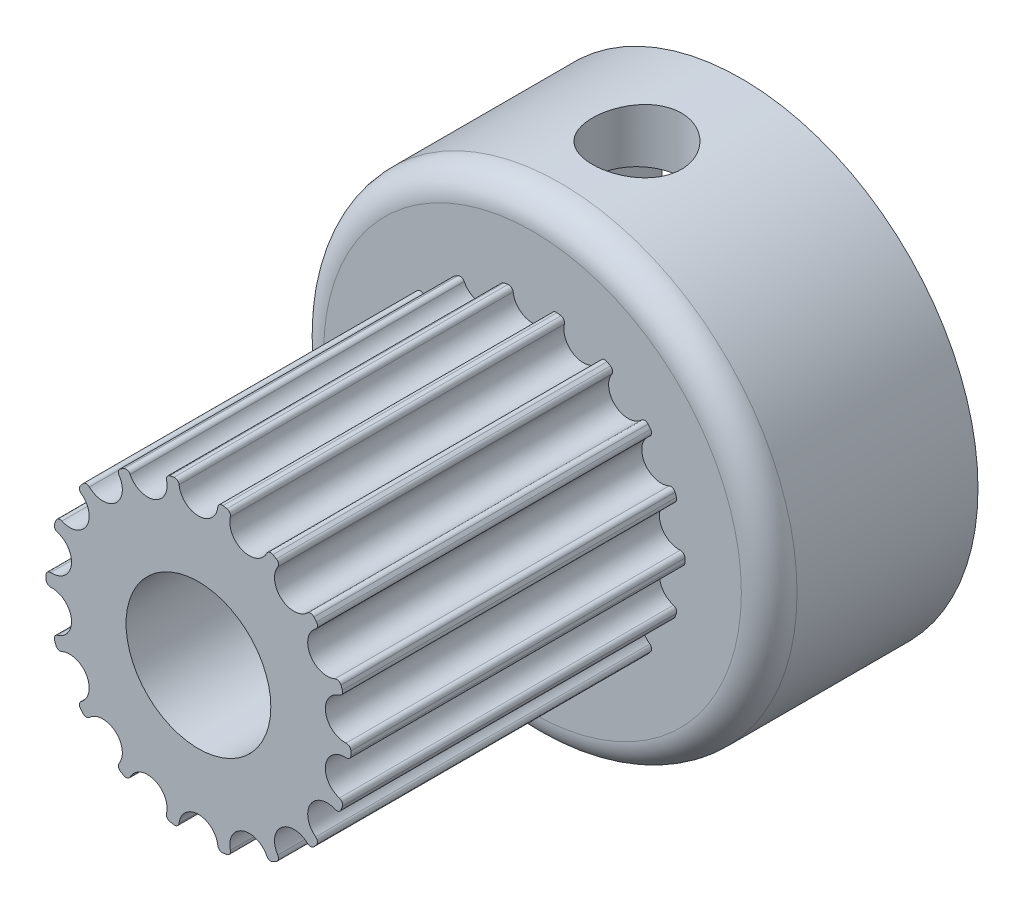
from build123d import *

# Parameters (mm, degrees)
SKETCH_1_R          = 8.5
SKETCH_1_R_2        = 2.6
EXTRUDE_1_DEPTH     = 7.5
FILLET_1_R          = 1
SKETCH_2_R          = 2.6
EXTRUDE_2_DEPTH     = 12
SKETCH_4_R          = 1.6
CUT_EXTRUDE_1_DEPTH = 23.907422415
SKETCH_5_W          = 5.7
SKETCH_5_H          = 2.7
CUT_EXTRUDE_2_DEPTH = 7.05


with BuildPart() as part:
    # 草图1 → 凸台-拉伸1 (new body)
    with BuildSketch(Plane.XY):
        Circle(SKETCH_1_R)
        Circle(SKETCH_1_R_2, mode=Mode.SUBTRACT)
    extrude(amount=EXTRUDE_1_DEPTH)

    # 圆角1
    fillet_1_edges = [part.edges().sort_by_distance(p)[0] for p in [
        (-8.5, 0, 7.5),
    ]]
    fillet(fillet_1_edges, radius=FILLET_1_R)

    # 草图2 → 凸台-拉伸2 (add)
    with BuildSketch(Plane.XY.offset(7.5)):
        with BuildLine():
            ThreePointArc((-0.880559418, 5.403724652), (-0.950723773, 5.391822448), (-1.020727493, 5.379009238))
            ThreePointArc((-1.020727493, 5.379009238), (-1.125431591, 5.308421125), (-1.14633793, 5.183887777))
            ThreePointArc((-1.14633793, 5.183887777), (-1.586973465, 4.36017376), (-2.453993032, 4.707940244))
            ThreePointArc((-2.453993032, 4.707940244), (-2.55005671, 4.789899987), (-2.675637867, 4.776671122))
            ThreePointArc((-2.675637867, 4.776671122), (-2.7375, 4.741489086), (-2.798899603, 4.705505925))
            ThreePointArc((-2.798899603, 4.705505925), (-2.873146715, 4.603363886), (-2.850199334, 4.479190428))
            ThreePointArc((-2.850199334, 4.479190428), (-2.982534509, 3.554446216), (-3.916209541, 3.584701658))
            ThreePointArc((-3.916209541, 3.584701658), (-4.034511753, 3.62886291), (-4.147994901, 3.573480558))
            ThreePointArc((-4.147994901, 3.573480558), (-4.194093326, 3.519262163), (-4.239483115, 3.464449151))
            ThreePointArc((-4.239483115, 3.464449151), (-4.274317943, 3.343073023), (-4.210284635, 3.234236608))
            ThreePointArc((-4.210284635, 3.234236608), (-4.018357874, 2.32), (-4.906073381, 2.029095147))
            ThreePointArc((-4.906073381, 2.029095147), (-5.032345136, 2.030131411), (-5.120042532, 1.9392755))
            ThreePointArc((-5.120042532, 1.9392755), (-5.144817099, 1.872560285), (-5.168722394, 1.80552868))
            ThreePointArc((-5.168722394, 1.80552868), (-5.159943344, 1.679558215), (-5.062547471, 1.59918612))
            ThreePointArc((-5.062547471, 1.59918612), (-4.569507974, 0.805727544), (-5.304192367, 0.228749815))
            ThreePointArc((-5.304192367, 0.228749815), (-5.423203425, 0.186536101), (-5.47453747, 0.071165197))
            ThreePointArc((-5.47453747, 0.071165197), (-5.475, 0), (-5.47453747, -0.071165197))
            ThreePointArc((-5.47453747, -0.071165197), (-5.423203425, -0.186536101), (-5.304192367, -0.228749815))
            ThreePointArc((-5.304192367, -0.228749815), (-4.569507974, -0.805727544), (-5.062547471, -1.59918612))
            ThreePointArc((-5.062547471, -1.59918612), (-5.159943344, -1.679558215), (-5.168722394, -1.80552868))
            ThreePointArc((-5.168722394, -1.80552868), (-5.144817099, -1.872560285), (-5.120042532, -1.9392755))
            ThreePointArc((-5.120042532, -1.9392755), (-5.032345136, -2.030131411), (-4.906073381, -2.029095147))
            ThreePointArc((-4.906073381, -2.029095147), (-4.018357874, -2.32), (-4.210284635, -3.234236608))
            ThreePointArc((-4.210284635, -3.234236608), (-4.274317943, -3.343073023), (-4.239483115, -3.464449151))
            ThreePointArc((-4.239483115, -3.464449151), (-4.194093326, -3.519262163), (-4.147994901, -3.573480558))
            ThreePointArc((-4.147994901, -3.573480558), (-4.034511753, -3.62886291), (-3.916209541, -3.584701658))
            ThreePointArc((-3.916209541, -3.584701658), (-2.982534509, -3.554446216), (-2.850199334, -4.479190428))
            ThreePointArc((-2.850199334, -4.479190428), (-2.873146715, -4.603363886), (-2.798899603, -4.705505925))
            ThreePointArc((-2.798899603, -4.705505925), (-2.7375, -4.741489086), (-2.675637867, -4.776671122))
            ThreePointArc((-2.675637867, -4.776671122), (-2.55005671, -4.789899987), (-2.453993032, -4.707940244))
            ThreePointArc((-2.453993032, -4.707940244), (-1.586973465, -4.36017376), (-1.14633793, -5.183887777))
            ThreePointArc((-1.14633793, -5.183887777), (-1.125431591, -5.308421125), (-1.020727493, -5.379009238))
            ThreePointArc((-1.020727493, -5.379009238), (-0.950723773, -5.391822448), (-0.880559418, -5.403724652))
            ThreePointArc((-0.880559418, -5.403724652), (-0.758027193, -5.373204434), (-0.695788747, -5.263331755))
            ThreePointArc((-0.695788747, -5.263331755), (0, -4.64), (0.695788747, -5.263331755))
            ThreePointArc((0.695788747, -5.263331755), (0.758027193, -5.373204434), (0.880559418, -5.403724652))
            ThreePointArc((0.880559418, -5.403724652), (0.950723773, -5.391822448), (1.020727493, -5.379009238))
            ThreePointArc((1.020727493, -5.379009238), (1.125431591, -5.308421125), (1.14633793, -5.183887777))
            ThreePointArc((1.14633793, -5.183887777), (1.586973465, -4.36017376), (2.453993032, -4.707940244))
            ThreePointArc((2.453993032, -4.707940244), (2.55005671, -4.789899987), (2.675637867, -4.776671122))
            ThreePointArc((2.675637867, -4.776671122), (2.7375, -4.741489086), (2.798899603, -4.705505925))
            ThreePointArc((2.798899603, -4.705505925), (2.873146715, -4.603363886), (2.850199334, -4.479190428))
            ThreePointArc((2.850199334, -4.479190428), (2.982534509, -3.554446216), (3.916209541, -3.584701658))
            ThreePointArc((3.916209541, -3.584701658), (4.034511753, -3.62886291), (4.147994901, -3.573480558))
            ThreePointArc((4.147994901, -3.573480558), (4.194093326, -3.519262163), (4.239483115, -3.464449151))
            ThreePointArc((4.239483115, -3.464449151), (4.274317943, -3.343073023), (4.210284635, -3.234236608))
            ThreePointArc((4.210284635, -3.234236608), (4.018357874, -2.32), (4.906073381, -2.029095147))
            ThreePointArc((4.906073381, -2.029095147), (5.032345136, -2.030131411), (5.120042532, -1.9392755))
            ThreePointArc((5.120042532, -1.9392755), (5.144817099, -1.872560285), (5.168722394, -1.80552868))
            ThreePointArc((5.168722394, -1.80552868), (5.159943344, -1.679558215), (5.062547471, -1.59918612))
            ThreePointArc((5.062547471, -1.59918612), (4.569507974, -0.805727544), (5.304192367, -0.228749815))
            ThreePointArc((5.304192367, -0.228749815), (5.423203425, -0.186536101), (5.47453747, -0.071165197))
            ThreePointArc((5.47453747, -0.071165197), (5.475, 0), (5.47453747, 0.071165197))
            ThreePointArc((5.47453747, 0.071165197), (5.423203425, 0.186536101), (5.304192367, 0.228749815))
            ThreePointArc((5.304192367, 0.228749815), (4.569507974, 0.805727544), (5.062547471, 1.59918612))
            ThreePointArc((5.062547471, 1.59918612), (5.159943344, 1.679558215), (5.168722394, 1.80552868))
            ThreePointArc((5.168722394, 1.80552868), (5.144817099, 1.872560285), (5.120042532, 1.9392755))
            ThreePointArc((5.120042532, 1.9392755), (5.032345136, 2.030131411), (4.906073381, 2.029095147))
            ThreePointArc((4.906073381, 2.029095147), (4.018357874, 2.32), (4.210284635, 3.234236608))
            ThreePointArc((4.210284635, 3.234236608), (4.274317943, 3.343073023), (4.239483115, 3.464449151))
            ThreePointArc((4.239483115, 3.464449151), (4.194093326, 3.519262163), (4.147994901, 3.573480558))
            ThreePointArc((4.147994901, 3.573480558), (4.034511753, 3.62886291), (3.916209541, 3.584701658))
            ThreePointArc((3.916209541, 3.584701658), (2.982534509, 3.554446216), (2.850199334, 4.479190428))
            ThreePointArc((2.850199334, 4.479190428), (2.873146715, 4.603363886), (2.798899603, 4.705505925))
            ThreePointArc((2.798899603, 4.705505925), (2.7375, 4.741489086), (2.675637867, 4.776671122))
            ThreePointArc((2.675637867, 4.776671122), (2.55005671, 4.789899987), (2.453993032, 4.707940244))
            ThreePointArc((2.453993032, 4.707940244), (1.586973465, 4.36017376), (1.14633793, 5.183887777))
            ThreePointArc((1.14633793, 5.183887777), (1.125431591, 5.308421125), (1.020727493, 5.379009238))
            ThreePointArc((1.020727493, 5.379009238), (0.950723773, 5.391822448), (0.880559418, 5.403724652))
            ThreePointArc((0.880559418, 5.403724652), (0.758027193, 5.373204434), (0.695788747, 5.263331755))
            ThreePointArc((0.695788747, 5.263331755), (0, 4.64), (-0.695788747, 5.263331755))
            ThreePointArc((-0.695788747, 5.263331755), (-0.758027193, 5.373204434), (-0.880559418, 5.403724652))
        make_face()
        Circle(SKETCH_2_R, mode=Mode.SUBTRACT)
    extrude(amount=EXTRUDE_2_DEPTH)

    # 草图4 → 切除-拉伸1 (cut, symmetric)
    with BuildSketch(Plane(origin=(0, 0, 0), x_dir=(1, 0, 0), z_dir=(0, 1, 0))):
        with Locations(Location((0, -3.75, 0), (0, 0, 270))):
            Circle(SKETCH_4_R)
    cut_extrude_1 = extrude(amount=CUT_EXTRUDE_1_DEPTH, both=True, mode=Mode.SUBTRACT)

    # 草图5 → 切除-拉伸2 (cut)
    with BuildSketch(Plane(origin=(0, 0, 0), x_dir=(-1, 0, 0), z_dir=(0, 0, -1))):
        with Locations((0, 5.15)):
            Rectangle(SKETCH_5_W, SKETCH_5_H)
    cut_extrude_2 = extrude(amount=-CUT_EXTRUDE_2_DEPTH, mode=Mode.SUBTRACT)

    # 镜向1: 切除-拉伸1, 切除-拉伸2 across plane
    add(cut_extrude_1.mirror(Plane.ZX), mode=Mode.SUBTRACT)
    add(cut_extrude_2.mirror(Plane.ZX), mode=Mode.SUBTRACT)


solid = part.part
